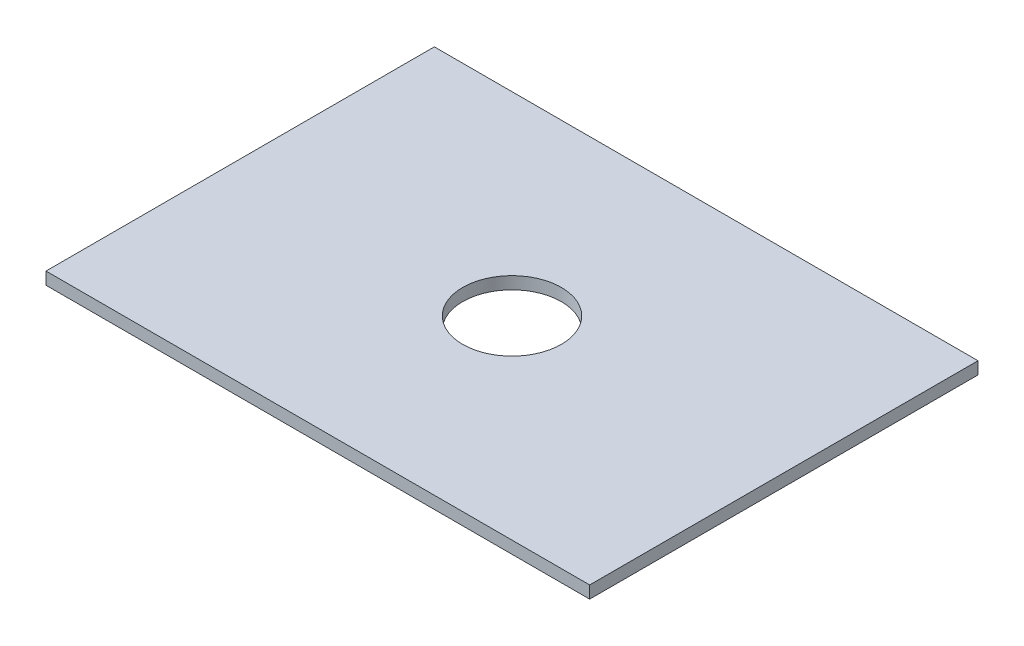
from build123d import *

# Parameters (mm, degrees)
SKETCH1_W           = 140
SKETCH1_H           = 100
BOSS_EXTRUDE1_DEPTH = 3.175
SKETCH2_R           = 12.705
CUT_EXTRUDE1_DEPTH  = 10


with BuildPart() as part:
    # Sketch1 → Boss-Extrude1 (new body)
    with BuildSketch(Plane(origin=(0, 0, 0), x_dir=(1, 0, 0), z_dir=(0, 1, 0))):
        with Locations((70, 50)):
            Rectangle(SKETCH1_W, SKETCH1_H)
    extrude(amount=BOSS_EXTRUDE1_DEPTH)

    # Sketch2 → Cut-Extrude1 (cut)
    with BuildSketch(Plane(origin=(0, 3.175, 0), x_dir=(1, 0, 0), z_dir=(0, 1, 0))):
        with Locations(Location((70, 50, 0), (0, 0, 270))):
            Circle(SKETCH2_R)
    extrude(amount=-CUT_EXTRUDE1_DEPTH, mode=Mode.SUBTRACT)


solid = part.part
